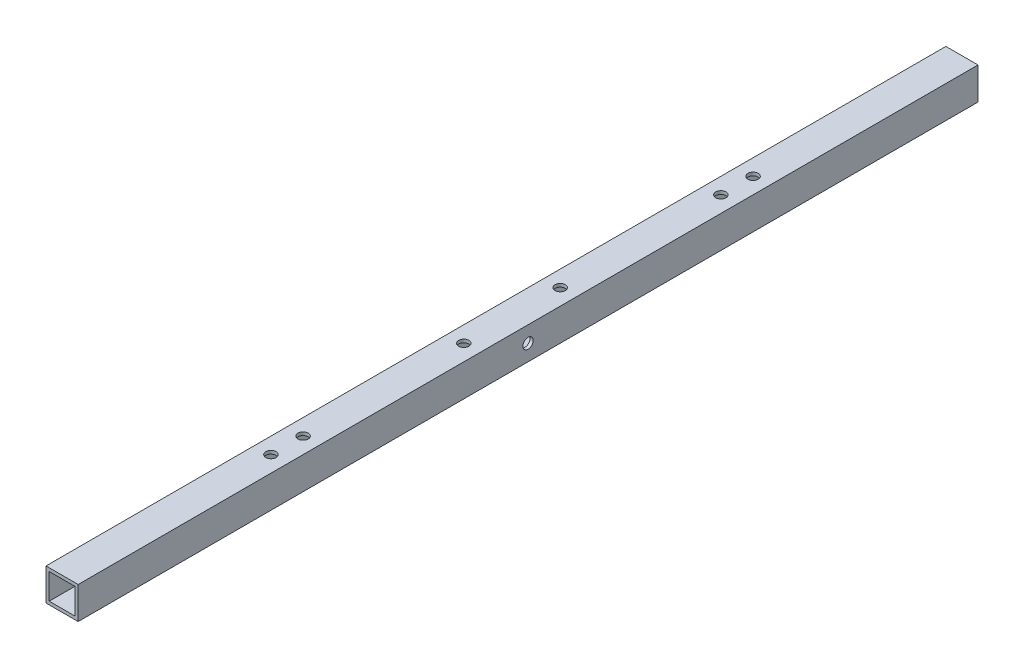
from build123d import *

# Parameters (mm, degrees)
SKETCH1_W           = 10
SKETCH1_H           = 10
SKETCH1_W_2         = 8
SKETCH1_H_2         = 8
BOSS_EXTRUDE1_DEPTH = 280
CUT_EXTRUDE1_REACH  = 282.223
SKETCH2_R           = 1.6
CUT_EXTRUDE2_REACH  = 282.223
SKETCH3_R           = 1.6


with BuildPart() as part:
    # Sketch1 → Boss-Extrude1 (new body)
    with BuildSketch(Plane.XY):
        Rectangle(SKETCH1_W, SKETCH1_H)
        Rectangle(SKETCH1_W_2, SKETCH1_H_2, mode=Mode.SUBTRACT)
    extrude(amount=BOSS_EXTRUDE1_DEPTH)

    # Cut-Extrude1: up to this face of the body (flat: up to its plane)
    cut_extrude1_end = Plane(part.part.faces().sort_by_distance((-5, 0, 140))[0])
    # Sketch2 → Cut-Extrude1 (cut, up to the picked face)
    with BuildSketch(Plane(origin=(5, 0, 0), x_dir=(0, 0, -1), z_dir=(1, 0, 0)), mode=Mode.PRIVATE) as cut_extrude1_sk1:
        with Locations(Location((-140, 0, 0), (0, 0, 90))):
            Circle(SKETCH2_R)
    cut_extrude1_tool1 = split(extrude(cut_extrude1_sk1.sketch, amount=-CUT_EXTRUDE1_REACH, mode=Mode.PRIVATE), bisect_by=cut_extrude1_end, keep=Keep.BOTH, mode=Mode.PRIVATE)
    add(cut_extrude1_tool1.solids().sort_by(Axis((5, 0, 140), (-1, 0, 0)))[0], mode=Mode.SUBTRACT)

    # Cut-Extrude2: up to this face of the body (flat: up to its plane)
    cut_extrude2_end = Plane(part.part.faces().sort_by_distance((0, -5, 140))[0])
    # Sketch3 → Cut-Extrude2 (cut, up to the picked face)
    with BuildSketch(Plane(origin=(0, 5, 0), x_dir=(1, 0, 0), z_dir=(0, 1, 0)), mode=Mode.PRIVATE) as cut_extrude2_sk1:
        with Locations(Location((0, -65, 0), (0, 0, 270))):
            Circle(SKETCH3_R)
    cut_extrude2_tool1 = split(extrude(cut_extrude2_sk1.sketch, amount=-CUT_EXTRUDE2_REACH, mode=Mode.PRIVATE), bisect_by=cut_extrude2_end, keep=Keep.BOTH, mode=Mode.PRIVATE)
    # Sketch3 → Cut-Extrude2 (cut, up to the picked face)
    with BuildSketch(Plane(origin=(0, 5, 0), x_dir=(1, 0, 0), z_dir=(0, 1, 0)), mode=Mode.PRIVATE) as cut_extrude2_sk2:
        with Locations(Location((0, -75, 0), (0, 0, 270))):
            Circle(SKETCH3_R)
    cut_extrude2_tool2 = split(extrude(cut_extrude2_sk2.sketch, amount=-CUT_EXTRUDE2_REACH, mode=Mode.PRIVATE), bisect_by=cut_extrude2_end, keep=Keep.BOTH, mode=Mode.PRIVATE)
    # Sketch3 → Cut-Extrude2 (cut, up to the picked face)
    with BuildSketch(Plane(origin=(0, 5, 0), x_dir=(1, 0, 0), z_dir=(0, 1, 0)), mode=Mode.PRIVATE) as cut_extrude2_sk3:
        with Locations(Location((0, -205, 0), (0, 0, 270))):
            Circle(SKETCH3_R)
    cut_extrude2_tool3 = split(extrude(cut_extrude2_sk3.sketch, amount=-CUT_EXTRUDE2_REACH, mode=Mode.PRIVATE), bisect_by=cut_extrude2_end, keep=Keep.BOTH, mode=Mode.PRIVATE)
    # Sketch3 → Cut-Extrude2 (cut, up to the picked face)
    with BuildSketch(Plane(origin=(0, 5, 0), x_dir=(1, 0, 0), z_dir=(0, 1, 0)), mode=Mode.PRIVATE) as cut_extrude2_sk4:
        with Locations(Location((0, -215, 0), (0, 0, 270))):
            Circle(SKETCH3_R)
    cut_extrude2_tool4 = split(extrude(cut_extrude2_sk4.sketch, amount=-CUT_EXTRUDE2_REACH, mode=Mode.PRIVATE), bisect_by=cut_extrude2_end, keep=Keep.BOTH, mode=Mode.PRIVATE)
    # Sketch3 → Cut-Extrude2 (cut, up to the picked face)
    with BuildSketch(Plane(origin=(0, 5, 0), x_dir=(1, 0, 0), z_dir=(0, 1, 0)), mode=Mode.PRIVATE) as cut_extrude2_sk5:
        with Locations(Location((0, -125, 0), (0, 0, 270))):
            Circle(SKETCH3_R)
    cut_extrude2_tool5 = split(extrude(cut_extrude2_sk5.sketch, amount=-CUT_EXTRUDE2_REACH, mode=Mode.PRIVATE), bisect_by=cut_extrude2_end, keep=Keep.BOTH, mode=Mode.PRIVATE)
    # Sketch3 → Cut-Extrude2 (cut, up to the picked face)
    with BuildSketch(Plane(origin=(0, 5, 0), x_dir=(1, 0, 0), z_dir=(0, 1, 0)), mode=Mode.PRIVATE) as cut_extrude2_sk6:
        with Locations(Location((0, -155, 0), (0, 0, 270))):
            Circle(SKETCH3_R)
    cut_extrude2_tool6 = split(extrude(cut_extrude2_sk6.sketch, amount=-CUT_EXTRUDE2_REACH, mode=Mode.PRIVATE), bisect_by=cut_extrude2_end, keep=Keep.BOTH, mode=Mode.PRIVATE)
    add(cut_extrude2_tool1.solids().sort_by(Axis((0, 5, 65), (0, -1, 0)))[0], mode=Mode.SUBTRACT)
    add(cut_extrude2_tool2.solids().sort_by(Axis((0, 5, 75), (0, -1, 0)))[0], mode=Mode.SUBTRACT)
    add(cut_extrude2_tool3.solids().sort_by(Axis((0, 5, 205), (0, -1, 0)))[0], mode=Mode.SUBTRACT)
    add(cut_extrude2_tool4.solids().sort_by(Axis((0, 5, 215), (0, -1, 0)))[0], mode=Mode.SUBTRACT)
    add(cut_extrude2_tool5.solids().sort_by(Axis((0, 5, 125), (0, -1, 0)))[0], mode=Mode.SUBTRACT)
    add(cut_extrude2_tool6.solids().sort_by(Axis((0, 5, 155), (0, -1, 0)))[0], mode=Mode.SUBTRACT)


solid = part.part
